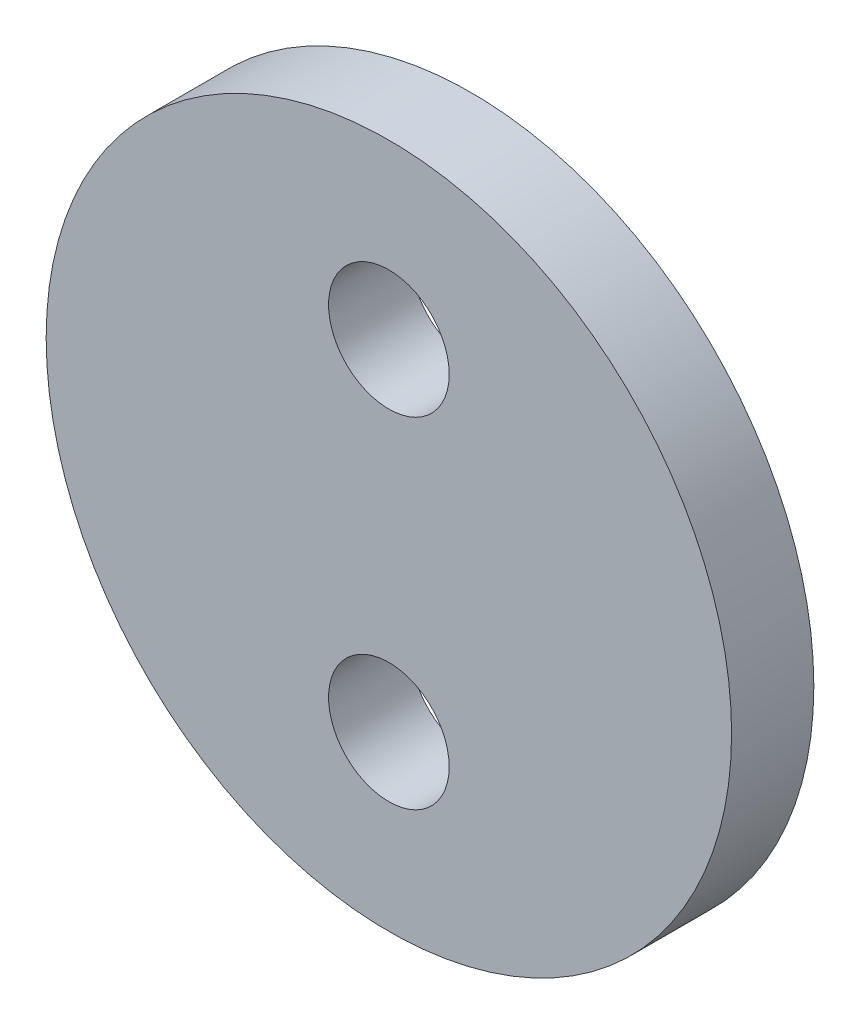
from build123d import *

# Parameters (mm, degrees)
SKETCH_1_R      = 12.5
SKETCH_1_R_2    = 2.2
EXTRUDE_1_DEPTH = 3


with BuildPart() as part:
    # 草图1 → 凸台-拉伸1 (new body)
    with BuildSketch(Plane.XY):
        Circle(SKETCH_1_R)
        with Locations((0, 6.2)):
            Circle(SKETCH_1_R_2, mode=Mode.SUBTRACT)
        with Locations((0, -6.2)):
            Circle(SKETCH_1_R_2, mode=Mode.SUBTRACT)
    extrude(amount=EXTRUDE_1_DEPTH)


solid = part.part
